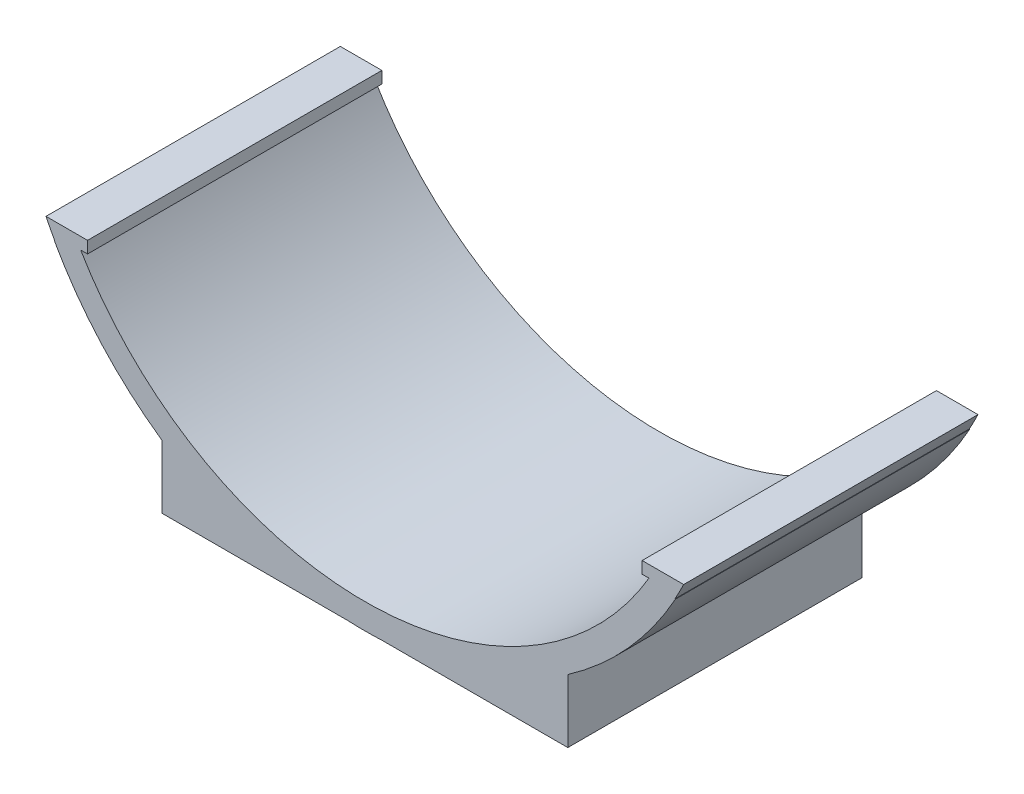
from build123d import *

# Parameters (mm, degrees)
SKETCH_1_R          = 210
SKETCH_1_R_2        = 203
EXTRUDE_2_DEPTH     = 174
EXTRUDE_START       = -174
EXTRUDE_4_DEPTH     = 174
CUT_EXTRUDE_1_DEPTH = 654
EXTRUDE_5_DEPTH     = 174
EXTRUDE_6_DEPTH     = 174
EXTRUDE_7_DEPTH     = 174
EXTRUDE_8_DEPTH     = 174


with BuildPart() as part:
    # 草图1 → 凸台-拉伸2 (new body)
    with BuildSketch(Plane.XY):
        Circle(SKETCH_1_R)
        Circle(SKETCH_1_R_2, mode=Mode.SUBTRACT)
    extrude(amount=EXTRUDE_2_DEPTH)

    # 草图2 → 凸台-拉伸4 (add)
    with BuildSketch(Plane.XY.offset(174).offset(EXTRUDE_START)):
        with BuildLine():
            Line((-170.735431044, -102), (-173.735431044, -102))
            Line((-173.735431044, -102), (-175.513532242, -102))
            ThreePointArc((-175.513532242, -102), (-174.63092392, -103.50381834), (-173.735431044, -105))
            Line((-173.735431044, -105), (-170.735431044, -105))
            Line((-170.735431044, -105), (-170.735431044, -102))
        make_face()
        with BuildLine():
            ThreePointArc((173.735431044, -105), (174.63092392, -103.50381834), (175.513532242, -102))
            Line((175.513532242, -102), (173.735431044, -102))
            Line((173.735431044, -102), (170.735431044, -102))
            Line((170.735431044, -102), (170.735431044, -105))
            Line((170.735431044, -105), (173.735431044, -105))
        make_face()
    extrude(amount=EXTRUDE_4_DEPTH)

    # 草图3 → 切除-拉伸1 (cut)
    with BuildSketch(Plane.XY.offset(174)):
        Polygon((-170.735431044, -102), (238.333646515, -102), (254.334169784, 272.292523591), (-334.569415043, 221.85110305), (-306.830562533, -102), align=None)
    extrude(amount=-CUT_EXTRUDE_1_DEPTH, mode=Mode.SUBTRACT)

    # 草图5 → 凸台-拉伸5 (add)
    with BuildSketch(Plane.XY.offset(174).offset(EXTRUDE_START)):
        with BuildLine():
            Line((-120, -209.75), (-10.243900624, -209.75))
            ThreePointArc((-10.243900624, -209.75), (-67.755470707, -198.769203322), (-120, -172.336879396))
            Line((-120, -172.336879396), (-120, -209.75))
        make_face()
        with BuildLine():
            ThreePointArc((120, -172.336879396), (67.755470707, -198.769203322), (10.243900624, -209.75))
            Line((10.243900624, -209.75), (120, -209.75))
            Line((120, -209.75), (120, -172.336879396))
        make_face()
    extrude(amount=EXTRUDE_5_DEPTH)

    # 草图6 → 凸台-拉伸6 (add)
    with BuildSketch(Plane.XY.offset(174).offset(EXTRUDE_START)):
        with BuildLine():
            Line((-175.513532242, -102), (-166.195667814, -102))
            ThreePointArc((-166.195667814, -102), (0, -195), (166.195667814, -102))
            Line((166.195667814, -102), (175.513532242, -102))
            ThreePointArc((175.513532242, -102), (0, -203), (-175.513532242, -102))
        make_face()
    extrude(amount=EXTRUDE_6_DEPTH)

    # 草图7 → 凸台-拉伸7 (add)
    with BuildSketch(Plane.XY.offset(174).offset(EXTRUDE_START)):
        with BuildLine():
            Line((-166.933126535, -92), (-166.933126535, -95))
            Line((-166.933126535, -95), (-170.293863659, -95))
            ThreePointArc((-170.293863659, -95), (0, -195), (170.293863659, -95))
            Line((170.293863659, -95), (166.933126535, -95))
            Line((166.933126535, -95), (166.933126535, -92))
            Line((166.933126535, -92), (171.933126535, -92))
            Line((171.933126535, -92), (188.496850106, -92))
            ThreePointArc((188.496850106, -92), (0, -209.75), (-188.496850106, -92))
            Line((-188.496850106, -92), (-171.933126535, -92))
            Line((-171.933126535, -92), (-166.933126535, -92))
        make_face()
    extrude(amount=EXTRUDE_7_DEPTH)

    # 草图8 → 凸台-拉伸8 (add)
    with BuildSketch(Plane(origin=(0, 0, 0), x_dir=(-1, 0, 0), z_dir=(0, 0, -1))):
        with BuildLine():
            Line((166.933126535, -92), (163.933126535, -92))
            Line((163.933126535, -92), (163.933126535, -99))
            Line((163.933126535, -99), (168, -99))
            ThreePointArc((168, -99), (169.158755456, -97.006780447), (170.293863659, -95))
            Line((170.293863659, -95), (166.933126535, -95))
            Line((166.933126535, -95), (166.933126535, -92))
        make_face()
        with BuildLine():
            Line((-166.933126535, -95), (-170.293863659, -95))
            ThreePointArc((-170.293863659, -95), (-169.158755456, -97.006780447), (-168, -99))
            Line((-168, -99), (-163.933126535, -99))
            Line((-163.933126535, -99), (-163.933126535, -92))
            Line((-163.933126535, -92), (-166.933126535, -92))
            Line((-166.933126535, -92), (-166.933126535, -95))
        make_face()
    extrude(amount=-EXTRUDE_8_DEPTH)


solid = part.part
